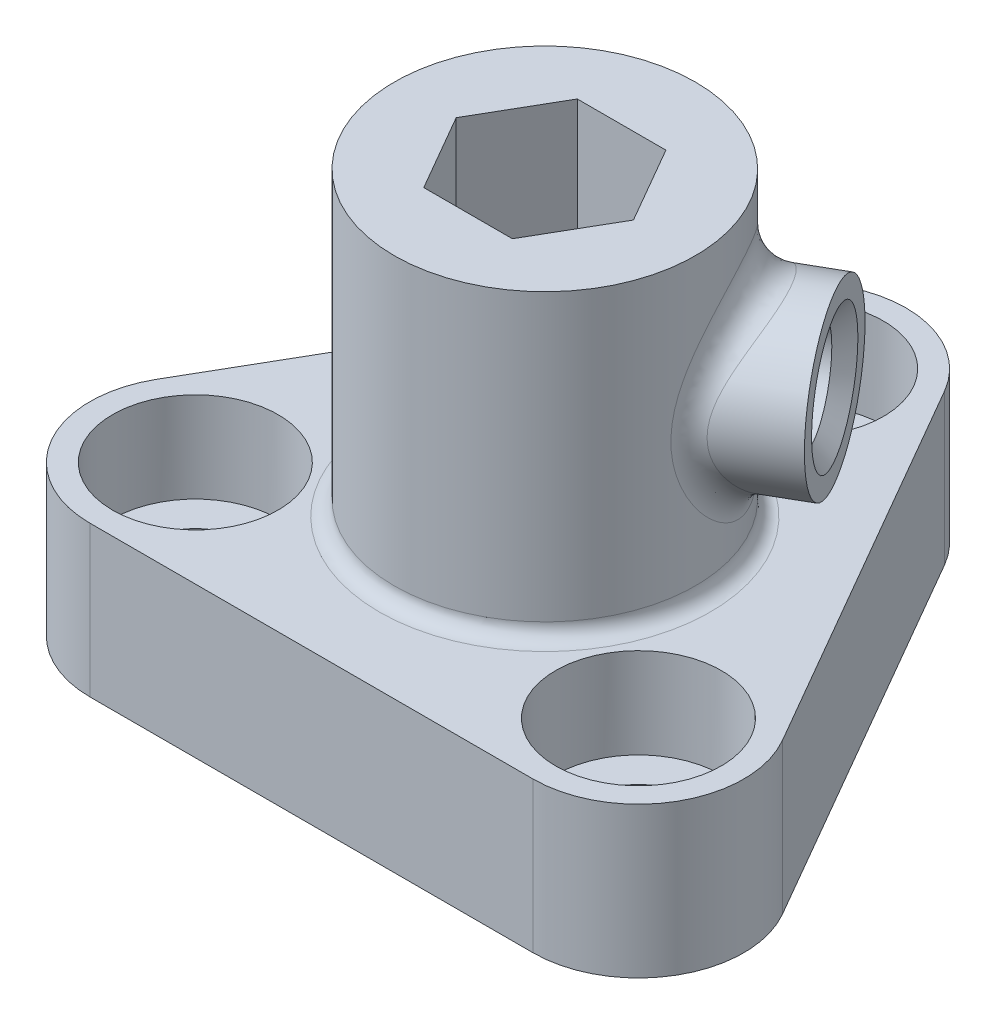
from build123d import *

# Parameters (mm, degrees)
SKETCH4_R                = 2.75
CUT_EXTRUDE4_DEPTH       = 3
SKETCH5_OUTSIDE_W        = 33.422
SKETCH5_OUTSIDE_H        = 33.422
CUT_EXTRUDE5_DEPTH       = 20.697715604
CUT_EXTRUDE2_DEPTH       = 10
BOSS_EXTRUDE1_REACH      = 27.298
BOSS_EXTRUDE1_END_RADIUS = 5
SKETCH3_R                = 2.75
CUT_EXTRUDE6_REACH       = 27.298
SKETCH6_R                = 1.6
FILLET1_R                = 0.5
CHAMFER1_SIZE            = 0.5
FILLET2_R                = 1
SKETCH7_R                = 1.55
CUT_EXTRUDE7_DEPTH       = 20.025404425


with BuildPart() as part:
    # Sketch1 → Revolve1 (revolve)
    with BuildSketch(Plane(origin=(0, 0, 0), x_dir=(0, 0, -1), z_dir=(1, 0, 0))):
        Polygon((0, 0), (12, 0), (12, 5), (5, 5), (5, 15), (0, 15), (0, 5.353547723), align=None)
    revolve(axis=Axis((0, 5.353547723, 0), (0, 1, 0)))

    # Sketch4 → Cut-Extrude4 (cut)
    with BuildSketch(Plane(origin=(0, 5, 0), x_dir=(1, 0, 0), z_dir=(0, 1, 0))):
        with Locations(Location((0, 8.5, 0), (0, 0, 270))):
            Circle(SKETCH4_R)
        with Locations(Location((7.361215932, -4.25, 0), (0, 0, 270))):
            Circle(SKETCH4_R)
        with Locations(Location((-7.361215932, -4.25, 0), (0, 0, 270))):
            Circle(SKETCH4_R)
    extrude(amount=-CUT_EXTRUDE4_DEPTH, mode=Mode.SUBTRACT)

    # Sketch5 outside → Cut-Extrude5 (cut, through all)
    with BuildSketch(Plane(origin=(0, 5, 0), x_dir=(1, 0, 0), z_dir=(0, 1, 0))):
        Rectangle(SKETCH5_OUTSIDE_W, SKETCH5_OUTSIDE_H)
        with BuildLine():
            Line((-3.031088913, 10.25), (-10.392304845, -2.5))
            ThreePointArc((-10.392304845, -2.5), (-10.392304845, -6), (-7.361215932, -7.75))
            Line((-7.361215932, -7.75), (7.361215932, -7.75))
            ThreePointArc((7.361215932, -7.75), (10.392304845, -6), (10.392304845, -2.5))
            Line((10.392304845, -2.5), (3.031088913, 10.25))
            ThreePointArc((3.031088913, 10.25), (0, 12), (-3.031088913, 10.25))
        make_face(mode=Mode.SUBTRACT)
    extrude(amount=-CUT_EXTRUDE5_DEPTH, mode=Mode.SUBTRACT)

    # Sketch2 → Cut-Extrude2 (cut)
    with BuildSketch(Plane(origin=(0, 15, 0), x_dir=(1, 0, 0), z_dir=(0, 1, 0))):
        Polygon((2.944486373, 0), (1.472243186, 2.55), (-1.472243186, 2.55), (-2.944486373, 0), (-1.472243186, -2.55), (1.472243186, -2.55), align=None)
    extrude(amount=-CUT_EXTRUDE2_DEPTH, mode=Mode.SUBTRACT)

    # Boss-Extrude1: up to this cylinder (the profile starts outside it)
    boss_extrude1_end = Plane(origin=(0, 10, 0), z_dir=(0, -1, 0)) * Cylinder(BOSS_EXTRUDE1_END_RADIUS, 65.596, mode=Mode.PRIVATE)
    # Sketch3 → Boss-Extrude1 (add, up to the surface)
    with BuildSketch(Plane(origin=(6.105479097, 0, -3.525), x_dir=(-0.5000000000000001, 0, -0.8660254037844386), z_dir=(0.8660254037844386, 0, -0.5000000000000001)), mode=Mode.PRIVATE) as boss_extrude1_sk1:
        with Locations((0, 10)):
            Circle(SKETCH3_R)
    boss_extrude1_tool1 = extrude(boss_extrude1_sk1.sketch, amount=-BOSS_EXTRUDE1_REACH, mode=Mode.PRIVATE) - boss_extrude1_end
    add(boss_extrude1_tool1.solids().sort_by_distance((6.105479, 10, -3.525))[0])

    # Sketch6 → Cut-Extrude6 (cut, up to next)
    with BuildSketch(Plane(origin=(6.105479097, 0, -3.525), x_dir=(-0.5000000000000001, 0, -0.8660254037844386), z_dir=(0.8660254037844386, 0, -0.5000000000000001)), mode=Mode.PRIVATE) as cut_extrude6_sk1:
        with Locations((0, 10)):
            Circle(SKETCH6_R)
    cut_extrude6_tool1 = extrude(cut_extrude6_sk1.sketch, amount=-CUT_EXTRUDE6_REACH, mode=Mode.PRIVATE) & part.part
    add(cut_extrude6_tool1.solids().sort_by_distance((6.105479, 10, -3.525))[0], mode=Mode.SUBTRACT)

    # Fillet1
    fillet1_edges = [part.edges().sort_by_distance(p)[0] for p in [
        (0, 5, 5),
    ]]
    fillet(fillet1_edges, radius=FILLET1_R)

    # Chamfer1
    chamfer1_edges = [part.edges().sort_by_distance(p)[0] for p in [
        (6.905479097, 10, -2.139359354),
    ]]
    chamfer(chamfer1_edges, length=CHAMFER1_SIZE)

    # Fillet2
    fillet2_edges = [part.edges().sort_by_distance(p)[0] for p in [
        (4.991369035, 9.999999998, 0.293658225),
    ]]
    fillet(fillet2_edges, radius=FILLET2_R)

    # Sketch7 → Cut-Extrude7 (cut, through all)
    with BuildSketch(Plane(origin=(0, 5, 0), x_dir=(1, 0, 0), z_dir=(0, 1, 0))):
        with Locations(Location((0, 8.5, 0), (0, 0, 270))):
            Circle(SKETCH7_R)
        with Locations(Location((7.361215932, -4.25, 0), (0, 0, 270))):
            Circle(SKETCH7_R)
        with Locations(Location((-7.361215932, -4.25, 0), (0, 0, 270))):
            Circle(SKETCH7_R)
    extrude(amount=-CUT_EXTRUDE7_DEPTH, mode=Mode.SUBTRACT)


solid = part.part
